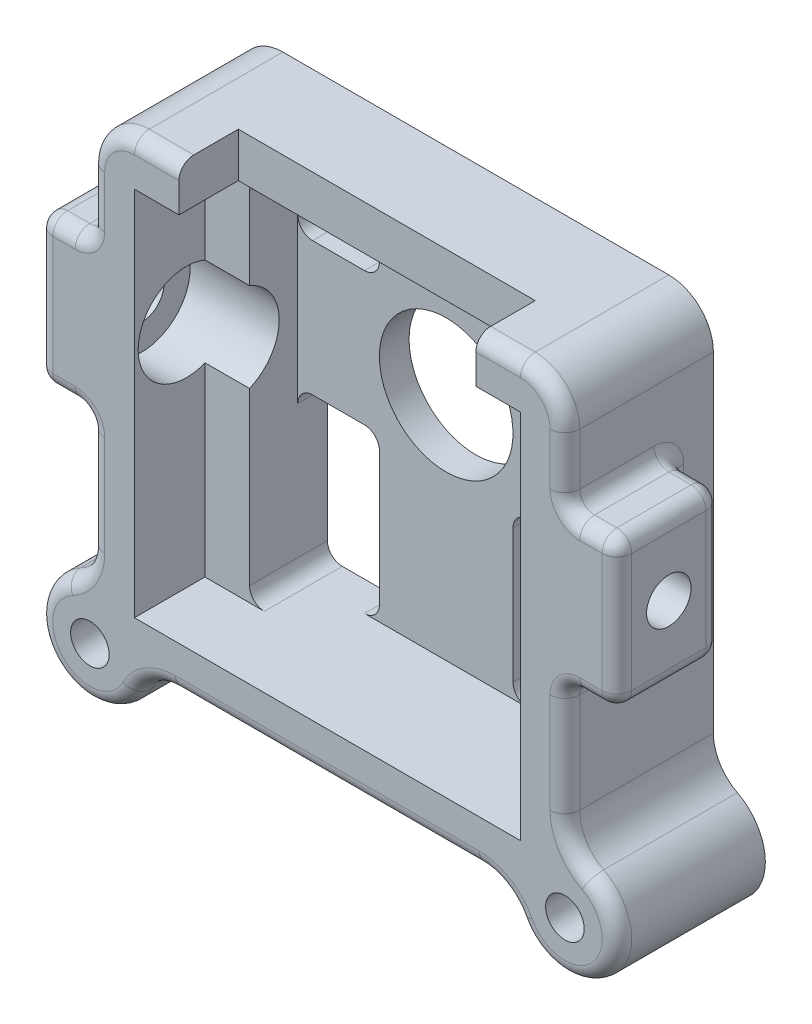
from build123d import *

# Parameters (mm, degrees)
SKETCH_1_W                   = 32
SKETCH_1_H                   = 31
SKETCH_1_W_2                 = 26
SKETCH_1_H_2                 = 25
EXTRUDE_1_DEPTH              = 10
EXTRUDE_2_DEPTH              = 2
SKETCH_4_W                   = 3
SKETCH_4_H                   = 25
EXTRUDE_3_DEPTH              = 5.25
SKETCH_5_W                   = 7
SKETCH_5_H                   = 10
EXTRUDE_4_DEPTH              = 3.5
HOLE_WIZARD_M3_1_D           = 3
HOLE_WIZARD_M3_1_DEPTH       = 9.5
HOLE_WIZARD_M3_1_CBORE_D     = 6.5
HOLE_WIZARD_M3_1_CBORE_DEPTH = 6
SKETCH_8_W                   = 20
SKETCH_8_H                   = 4
CUT_EXTRUDE_1_DEPTH          = 3
SKETCH_11_R                  = 3.5
EXTRUDE_5_DEPTH              = 10
HOLE_WIZARD_2_6_2_6_1_D      = 2.6
FILLET_1_R                   = 3
FILLET_2_R                   = 1


with BuildPart() as part:
    # 草圖1 → 填料-伸長1 (new body)
    with BuildSketch(Plane.XY):
        Rectangle(SKETCH_1_W, SKETCH_1_H)
        Rectangle(SKETCH_1_W_2, SKETCH_1_H_2, mode=Mode.SUBTRACT)
    extrude(amount=-EXTRUDE_1_DEPTH)

    # 草圖2 → 填料-伸長2 (add)
    with BuildSketch(Plane(origin=(0, 0, -10), x_dir=(-1, 0, 0), z_dir=(0, 0, -1))):
        Polygon((13, 7.5), (4.5, 7.5), (4.5, 3), (4.5, -1.5), (13, -1.5), align=None)
        with BuildLine():
            Line((4.5, 7.5), (0, 7.5))
            ThreePointArc((0, 7.5), (3.181980515, 6.181980515), (4.5, 3))
            Line((4.5, 3), (4.5, 7.5))
        make_face()
        with BuildLine():
            ThreePointArc((4.5, 3), (3.181980521, -0.181980509), (1.7e-08, -1.5))
            Line((1.7e-08, -1.5), (4.5, -1.5))
            Line((4.5, -1.5), (4.5, 3))
        make_face()
        with BuildLine():
            ThreePointArc((1.7e-08, -1.5), (-3.181980517, -0.181980513), (-4.5, 3.000000023))
            Line((-4.5, 3.000000023), (-4.5, -1.5))
            Line((-4.5, -1.5), (1.7e-08, -1.5))
        make_face()
        with BuildLine():
            Line((0, 7.5), (-4.5, 7.5))
            Line((-4.5, 7.5), (-4.5, 3.000000023))
            ThreePointArc((-4.5, 3.000000023), (-3.181980507, 6.181980523), (0, 7.5))
        make_face()
        Polygon((4.5, 12.5), (-4.5, 12.5), (-4.5, 7.5), (0, 7.5), (4.5, 7.5), align=None)
        Polygon((-4.5, 3.000000023), (-4.5, 7.5), (-13, 7.5), (-13, -1.5), (-4.5, -1.5), align=None)
        Polygon((1.7e-08, -1.5), (-4.5, -1.5), (-4.5, -12.5), (4.5, -12.5), (4.5, -1.5), align=None)
    extrude(amount=-EXTRUDE_2_DEPTH)

    # 草圖4 → 填料-伸長3 (add)
    with BuildSketch(Plane(origin=(0, 0, -10), x_dir=(-1, 0, 0), z_dir=(0, 0, -1))):
        with Locations((-11.5, 0)):
            Rectangle(SKETCH_4_W, SKETCH_4_H)
    extrude_3 = extrude(amount=-EXTRUDE_3_DEPTH)

    # 鏡射1: 填料-伸長3 across plane
    add(extrude_3.mirror(Plane(origin=(0, 0, 0), x_dir=(0, 0, 1), z_dir=(1, 0, 0))))

    # 草圖5 → 填料-伸長4 (add)
    with BuildSketch(Plane(origin=(16, 0, 0), x_dir=(0, 0, -1), z_dir=(1, 0, 0))):
        with Locations((3.5, 3)):
            Rectangle(SKETCH_5_W, SKETCH_5_H)
    extrude_4 = extrude(amount=EXTRUDE_4_DEPTH)

    # M3 六角承窩頭蓋螺釘的柱孔1
    with Locations(Plane.ZY.offset(-10)):
        with Locations((-3.5, 3)):
            hole_wizard_m3_1 = CounterBoreHole(HOLE_WIZARD_M3_1_D / 2, HOLE_WIZARD_M3_1_CBORE_D / 2, HOLE_WIZARD_M3_1_CBORE_DEPTH, depth=HOLE_WIZARD_M3_1_DEPTH)

    # 鏡射2: 填料-伸長4, M3 六角承窩頭蓋螺釘的柱孔1 across plane
    add(extrude_4.mirror(Plane(origin=(0, 0, 0), x_dir=(0, 0, 1), z_dir=(1, 0, 0))))
    add(hole_wizard_m3_1.mirror(Plane(origin=(0, 0, 0), x_dir=(0, 0, 1), z_dir=(1, 0, 0))), mode=Mode.SUBTRACT)

    # 草圖8 → 除料-伸長1 (cut)
    with BuildSketch(Plane(origin=(0, 15.5, 0), x_dir=(1, 0, 0), z_dir=(0, 1, 0))):
        with Locations((0, 2)):
            Rectangle(SKETCH_8_W, SKETCH_8_H)
    extrude(amount=-CUT_EXTRUDE_1_DEPTH, mode=Mode.SUBTRACT)

    # 草圖11 → 填料-伸長5 (add)
    with BuildSketch(Plane.XY):
        with Locations((16, -15.5)):
            Circle(SKETCH_11_R)
    extrude_5 = extrude(amount=-EXTRUDE_5_DEPTH)

    # Ø2.6 (2.6) 直徑孔1 (through all)
    with Locations(Plane.XY):
        with Locations((16, -15.5)):
            hole_wizard_2_6_2_6_1 = Hole(HOLE_WIZARD_2_6_2_6_1_D / 2)

    # 鏡射3: 填料-伸長5, Ø2.6 (2.6) 直徑孔1 across plane
    add(extrude_5.mirror(Plane(origin=(0, 0, 0), x_dir=(0, 0, 1), z_dir=(1, 0, 0))))
    add(hole_wizard_2_6_2_6_1.mirror(Plane(origin=(0, 0, 0), x_dir=(0, 0, 1), z_dir=(1, 0, 0))), mode=Mode.SUBTRACT)

    # 圓角1
    fillet_1_edges = [part.edges().sort_by_distance(p)[0] for p in [
        (16, -12, -5),
        (12.5, -15.5, -5),
        (-16, -12, -5),
        (-12.5, -15.5, -5),
        (-16, 15.5, -5),
        (16, 15.5, -5),
    ]]
    fillet(fillet_1_edges, radius=FILLET_1_R)

    # 圓角2
    fillet_2_edges = [part.edges().sort_by_distance(p)[0] for p in [
        (-10, 7.5, -9),
        (-10, -12.5, -7.375),
        (-10, -1.5, -9),
        (-10, 12.5, -7.375),
        (16, 10.25, 0),
        (16, 3, -7),
        (17.75, -2, -7),
        (16, 8, -3.5),
        (17.75, 8, -7),
        (17.75, 8, 0),
        (16, -2, -3.5),
        (17.75, -2, 0),
        (19.5, 3, -7),
        (19.5, 8, -3.5),
        (19.5, 3, 0),
        (19.5, -2, -3.5),
        (-16, -5.866859351, 0),
        (-19.5, 3, -7),
        (-17.75, 8, -7),
        (-19.5, -2, -3.5),
        (-17.75, -2, -7),
        (-19.5, 3, 0),
        (-17.75, -2, 0),
        (-19.5, 8, -3.5),
        (-17.75, 8, 0),
        (-16, 3, -7),
        (-16, 8, -3.5),
        (-16, -2, -3.5),
        (-11.5, 15.5, 0),
        (16, -5.866859351, 0),
        (-18.474873734, -17.974873734, 0),
        (0, -15.5, 0),
        (18.474873734, -17.974873734, 0),
        (11.5, 15.5, 0),
        (-16, 10.25, 0),
        (-15.121320344, 14.621320344, 0),
        (15.121320344, 14.621320344, 0),
        (16.435448757, -11.290342268, 0),
        (11.790342268, -15.935448757, 0),
        (-11.790342268, -15.935448757, 0),
        (-16.435448757, -11.290342268, 0),
        (-4.5, 7.5, -9),
        (-4.5, -1.5, -9),
        (-4.5, -12.5, -9),
        (4.5, -12.5, -9),
        (4.5, -1.5, -9),
        (4.5, 7.5, -9),
        (4.5, 12.5, -9),
        (-4.5, 12.5, -9),
        (10, 7.5, -9),
        (10, -1.5, -9),
        (10, 12.5, -7.375),
        (10, -12.5, -7.375),
    ]]
    fillet(fillet_2_edges, radius=FILLET_2_R)


solid = part.part
